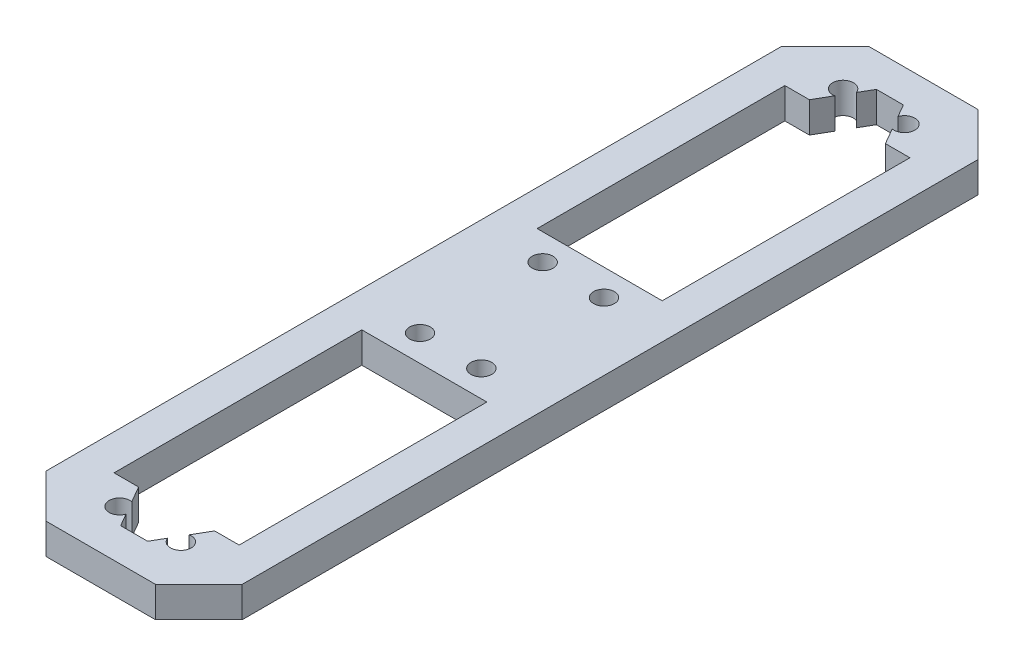
from build123d import *

# Parameters (mm, degrees)
SKETCH_1_R      = 1.7
EXTRUDE_1_DEPTH = 5


with BuildPart() as part:
    # 草图1 → 凸台-拉伸1 (new body)
    with BuildSketch(Plane(origin=(0, 0, 0), x_dir=(1, 0, 0), z_dir=(0, 1, 0))):
        Polygon((2550.050393087, 1533.227125386), (2557.121460899, 1540.298193198), (2574.979325275, 1540.298193198), (2582.050393087, 1533.227125386), (2582.050393087, 1413.227125386), (2574.979325275, 1406.156057575), (2557.121460899, 1406.156057575), (2550.050393087, 1413.227125386), align=None)
        with Locations(Location((2571.050393087, 1483.227125386, 0), (0, 0, 270))):
            Circle(SKETCH_1_R, mode=Mode.SUBTRACT)
        with Locations(Location((2561.050393087, 1483.227125386, 0), (0, 0, 270))):
            Circle(SKETCH_1_R, mode=Mode.SUBTRACT)
        with Locations(Location((2561.050393087, 1463.227125386, 0), (0, 0, 270))):
            Circle(SKETCH_1_R, mode=Mode.SUBTRACT)
        with Locations(Location((2571.050393087, 1463.227125386, 0), (0, 0, 270))):
            Circle(SKETCH_1_R, mode=Mode.SUBTRACT)
        with BuildLine():
            Line((2576.250393087, 1487.527125386), (2555.850393087, 1487.527125386))
            Line((2555.850393087, 1487.527125386), (2555.850393087, 1527.927125386))
            Line((2555.850393087, 1527.927125386), (2559.850393087, 1527.927125386))
            Line((2559.850393087, 1527.927125386), (2561.368882267, 1530.557225796))
            ThreePointArc((2561.368882267, 1530.557225796), (2559.578149901, 1533.077125386), (2562.655813144, 1532.786255462))
            Line((2562.655813144, 1532.786255462), (2563.850393087, 1534.855328617))
            Line((2563.850393087, 1534.855328617), (2568.250393087, 1534.855328617))
            Line((2568.250393087, 1534.855328617), (2569.44497303, 1532.786255462))
            ThreePointArc((2569.44497303, 1532.786255462), (2572.522636274, 1533.077125386), (2570.731903908, 1530.557225796))
            Line((2570.731903908, 1530.557225796), (2572.250393087, 1527.927125386))
            Line((2572.250393087, 1527.927125386), (2576.250393087, 1527.927125386))
            Line((2576.250393087, 1527.927125386), (2576.250393087, 1487.527125386))
        make_face(mode=Mode.SUBTRACT)
        with BuildLine():
            Line((2555.850393087, 1458.927125386), (2576.250393087, 1458.927125386))
            Line((2576.250393087, 1458.927125386), (2576.250393087, 1418.527125386))
            Line((2576.250393087, 1418.527125386), (2572.250393087, 1418.527125386))
            Line((2572.250393087, 1418.527125386), (2570.731903908, 1415.897024977))
            ThreePointArc((2570.731903908, 1415.897024977), (2572.522636274, 1413.377125386), (2569.44497303, 1413.667995311))
            Line((2569.44497303, 1413.667995311), (2568.250393087, 1411.598922156))
            Line((2568.250393087, 1411.598922156), (2563.850393087, 1411.598922156))
            Line((2563.850393087, 1411.598922156), (2562.655813144, 1413.667995311))
            ThreePointArc((2562.655813144, 1413.667995311), (2559.578149901, 1413.377125386), (2561.368882267, 1415.897024977))
            Line((2561.368882267, 1415.897024977), (2559.850393087, 1418.527125386))
            Line((2559.850393087, 1418.527125386), (2555.850393087, 1418.527125386))
            Line((2555.850393087, 1418.527125386), (2555.850393087, 1458.927125386))
        make_face(mode=Mode.SUBTRACT)
    extrude(amount=EXTRUDE_1_DEPTH)


solid = part.part
